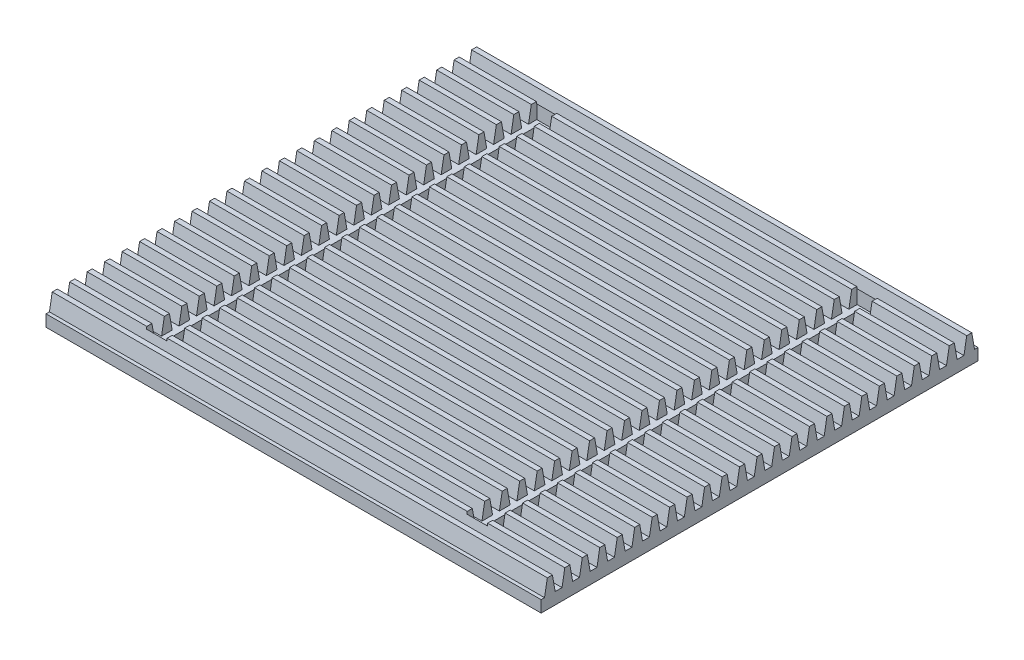
from build123d import *

# Parameters (mm, degrees)
BOSS_EXTRUDE1_DEPTH = 170
LPATTERN1_COUNT     = 25
LPATTERN1_PITCH     = 6
SKETCH2_W           = 3
SKETCH2_H           = 130
CUT_EXTRUDE1_DEPTH  = 10
CUT_EXTRUDE3_REACH  = 228.781
SKETCH3_W           = 7
SKETCH3_H           = 134


with BuildPart() as part:
    # Sketch1 → Boss-Extrude1 (new body)
    with BuildSketch(Plane(origin=(0, 0, 0), x_dir=(0, 0, -1), z_dir=(1, 0, 0))):
        Polygon((0, 0), (6, 0), (6, 4), (4.826453954, 4), (3.868289151, 9.434022626), (2.131710849, 9.434022626), (1.173546046, 4), (0, 4), align=None)
    boss_extrude1 = extrude(amount=BOSS_EXTRUDE1_DEPTH)

    # LPattern1: Boss-Extrude1 ×25
    with Locations(*[(0, 0, -i * LPATTERN1_PITCH) for i in range(1, LPATTERN1_COUNT)]):
        add(boss_extrude1)

    # Sketch2 → Cut-Extrude1 (cut)
    with BuildSketch(Plane.XZ):
        with Locations((30, -75)):
            Rectangle(SKETCH2_W, SKETCH2_H)
    cut_extrude1 = extrude(amount=-CUT_EXTRUDE1_DEPTH, mode=Mode.SUBTRACT)

    # Cut-Extrude3: up to this face of the body (flat: up to its plane)
    cut_extrude3_end = Plane(part.part.faces().sort_by_distance((100.75, 9.434022626, -63))[0])
    # Sketch3 → Cut-Extrude3 (cut, up to the picked face)
    with BuildSketch(Plane(origin=(0, 4, 0), x_dir=(1, 0, 0), z_dir=(0, 1, 0)), mode=Mode.PRIVATE) as cut_extrude3_sk1:
        with Locations((30, 75)):
            Rectangle(SKETCH3_W, SKETCH3_H)
    cut_extrude3_tool1 = split(extrude(cut_extrude3_sk1.sketch, amount=CUT_EXTRUDE3_REACH, mode=Mode.PRIVATE), bisect_by=cut_extrude3_end, keep=Keep.BOTH, mode=Mode.PRIVATE)
    cut_extrude3 = cut_extrude3_tool1.solids().sort_by(Axis((30, 4, -75), (0, 1, 0)))[0]
    add(cut_extrude3, mode=Mode.SUBTRACT)

    # Mirror1: Cut-Extrude1, Cut-Extrude3 across plane
    add(cut_extrude1.mirror(Plane(origin=(85, 0, 0), x_dir=(0, 0, 1), z_dir=(1, 0, 0))), mode=Mode.SUBTRACT)
    add(cut_extrude3.mirror(Plane(origin=(85, 0, 0), x_dir=(0, 0, 1), z_dir=(1, 0, 0))), mode=Mode.SUBTRACT)


solid = part.part
